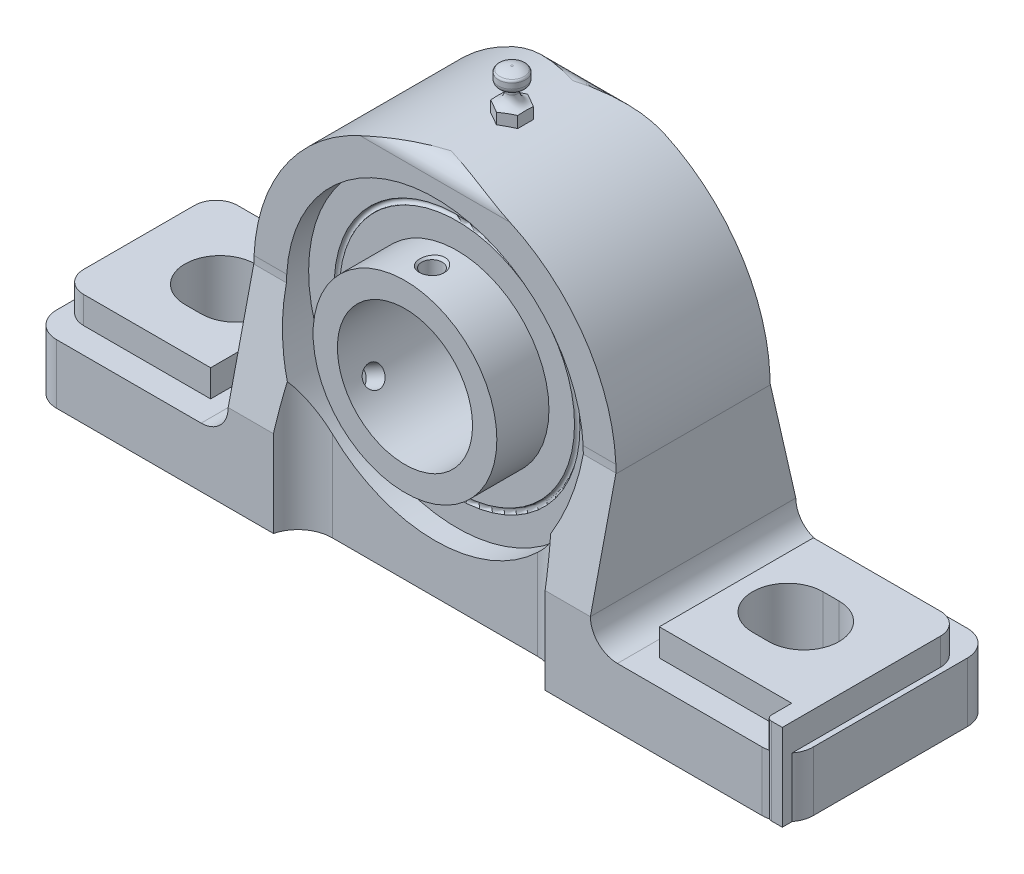
from build123d import *

# Parameters (mm, degrees)
EXTRUDE1_DEPTH      = 3
EXTRUDE1_DEPTH_BACK = 3
SKETCH2_W           = 43.479381443
SKETCH2_H           = 47.087628866
EXTRUDE2_DEPTH      = 19
EXTRUDE2_DEPTH_BACK = 19
SKETCH3_R           = 27.458477013
EXTRUDE3_DEPTH      = 70
EXTRUDE3_DEPTH_BACK = 70
SKETCH5_W           = 560
SKETCH5_H           = 152
EXTRUDE4_DEPTH      = 36.5
EXTRUDE5_REACH      = 97.42
EXTRUDE6_DEPTH      = 16
EXTRUDE7_DEPTH      = 96.420123749
CIRPATTERN1_COUNT   = 2
CIRPATTERN1_ANGLE   = 120


with BuildPart() as part:
    # Sketch1 → Revolve1 (revolve)
    with BuildSketch(Plane(origin=(0, 0, 0), x_dir=(0, 0, -1), z_dir=(1, 0, 0)), mode=Mode.PRIVATE) as revolve1_sk:
        with BuildLine():
            Line((0, 78), (0.17820323, 78))
            ThreePointArc((0.17820323, 78), (1.259498067, 77.851077963), (2.260278589, 77.415400738))
            ThreePointArc((2.260278589, 77.415400738), (2.434907396, 77.235198628), (2.5, 76.992853886))
            Line((2.5, 76.992853886), (2.5, 76.003209488))
            ThreePointArc((2.5, 76.003209488), (2.21161732, 75.293562514), (1.505707946, 74.996148066))
            ThreePointArc((1.505707946, 74.996148066), (1.149821103, 74.853091094), (1, 74.4999985))
            Line((1, 74.4999985), (1, 74))
            ThreePointArc((1, 74), (1.585786438, 72.585786438), (3, 72))
            Line((3, 72), (5, 72))
            Line((5, 72), (5, 68))
            Line((5, 68), (0, 68))
            Line((0, 68), (0, 78))
        make_face()
    revolve(revolve1_sk.sketch.rotate(Axis((0, 68, 0), (0, 1, 0)), 180), axis=Axis((0, 68, 0), (0, 1, 0)))

    # Sketch2 → Extrude1 (cut, two sides: drawn at the far end of the back side and taken through both)
    with BuildSketch(Plane(origin=(0, 70, 0), x_dir=(-1, 0, 0), z_dir=(0, 1, 0)).offset(-EXTRUDE1_DEPTH_BACK)):
        with Locations((-0.902061855, 2.255154639)):
            Rectangle(SKETCH2_W, SKETCH2_H)
        Polygon((2.5, -1.443375673), (2.5, 1.443375673), (0, 2.886751346), (-2.5, 1.443375673), (-2.5, -1.443375673), (0, -2.886751346), align=None, mode=Mode.SUBTRACT)
    extrude(amount=EXTRUDE1_DEPTH + EXTRUDE1_DEPTH_BACK, mode=Mode.SUBTRACT)

    # Sketch3 → Extrude2 (add, two sides: drawn at the far end of the back side and taken through both)
    with BuildSketch(Plane.XY.offset(-EXTRUDE2_DEPTH_BACK)):
        with BuildLine():
            Line((-70, 0), (70, 0))
            Line((70, 0), (70, 11))
            Line((70, 11), (38.5, 11))
            ThreePointArc((38.5, 11), (34.964466094, 12.464466094), (33.5, 16))
            Line((33.5, 16), (33.5, 36.5))
            ThreePointArc((33.5, 36.5), (0, 70), (-33.5, 36.5))
            Line((-33.5, 36.5), (-33.5, 16))
            ThreePointArc((-33.5, 16), (-34.964466094, 12.464466094), (-38.5, 11))
            Line((-38.5, 11), (-70, 11))
            Line((-70, 11), (-70, 0))
        make_face()
        with Locations((0, 36.5)):
            Circle(SKETCH3_R, mode=Mode.SUBTRACT)
    extrude(amount=EXTRUDE2_DEPTH + EXTRUDE2_DEPTH_BACK)

    # Sketch4 → Extrude3 (cut, two sides: drawn at the far end of the back side and taken through both)
    with BuildSketch(Plane(origin=(0, 0, 0), x_dir=(0, 0, -1), z_dir=(1, 0, 0)).offset(-EXTRUDE3_DEPTH_BACK)):
        Polygon((-76, -140), (76, -140), (86.807661708, 204.646339854), (-78.337871198, 217.811941299), align=None)
        with BuildLine():
            Line((-19, 0), (19, 0))
            Line((19, 0), (19, 16))
            Line((19, 16), (14.27198734, 36.629075452))
            ThreePointArc((14.27198734, 36.629075452), (14.255497188, 37.314449572), (14.25, 38))
            Line((14.25, 38), (14.25, 67))
            ThreePointArc((14.25, 67), (13.371320344, 69.121320344), (11.25, 70))
            Line((11.25, 70), (9.3, 70))
            Line((9.3, 70), (9.3, 84.956701031))
            Line((9.3, 84.956701031), (-9.3, 84.956701031))
            Line((-9.3, 84.956701031), (-9.3, 70))
            Line((-9.3, 70), (-11.25, 70))
            ThreePointArc((-11.25, 70), (-13.371320344, 69.121320344), (-14.25, 67))
            Line((-14.25, 67), (-14.25, 38))
            ThreePointArc((-14.25, 38), (-14.255497188, 37.314449572), (-14.27198734, 36.629075452))
            Line((-14.27198734, 36.629075452), (-19, 16))
            Line((-19, 16), (-19, 0))
        make_face(mode=Mode.SUBTRACT)
    extrude(amount=EXTRUDE3_DEPTH + EXTRUDE3_DEPTH_BACK, mode=Mode.SUBTRACT)

    # Sketch5 → Extrude4 (cut)
    with BuildSketch(Plane(origin=(0, 0, 0), x_dir=(1, 0, 0), z_dir=(0, 1, 0))):
        Rectangle(SKETCH5_W, SKETCH5_H)
        with BuildLine():
            Line((-70, 14.25), (-70, -14.25))
            ThreePointArc((-70, -14.25), (-68.608757211, -17.608757211), (-65.25, -19))
            Line((-65.25, -19), (-30.25, -19))
            Line((-30.25, -19), (-25.333333333, -20.583333333))
            ThreePointArc((-25.333333333, -20.583333333), (-23.478342948, -16.104990386), (-19, -14.25))
            Line((-19, -14.25), (19, -14.25))
            ThreePointArc((19, -14.25), (23.478342948, -16.104990386), (25.333333333, -20.583333333))
            Line((25.333333333, -20.583333333), (30.25, -19))
            Line((30.25, -19), (65.25, -19))
            ThreePointArc((65.25, -19), (68.608757211, -17.608757211), (70, -14.25))
            Line((70, -14.25), (70, 14.25))
            ThreePointArc((70, 14.25), (68.608757211, 17.608757211), (65.25, 19))
            Line((65.25, 19), (30.25, 19))
            Line((30.25, 19), (25.333333333, 20.583333333))
            ThreePointArc((25.333333333, 20.583333333), (23.478342948, 16.104990386), (19, 14.25))
            Line((19, 14.25), (-19, 14.25))
            ThreePointArc((-19, 14.25), (-23.478342948, 16.104990386), (-25.333333333, 20.583333333))
            Line((-25.333333333, 20.583333333), (-30.25, 19))
            Line((-30.25, 19), (-65.25, 19))
            ThreePointArc((-65.25, 19), (-68.608757211, 17.608757211), (-70, 14.25))
        make_face(mode=Mode.SUBTRACT)
    extrude(amount=EXTRUDE4_DEPTH, mode=Mode.SUBTRACT)

    # Extrude5: up to this face of the body (flat: up to its plane)
    extrude5_end = Plane(part.part.faces().sort_by_distance((0, 0, 0))[0])
    # Sketch6 → Extrude5 (add, up to the picked face)
    with BuildSketch(Plane(origin=(0, 16, 0), x_dir=(-1, 0, 0), z_dir=(0, 1, 0)), mode=Mode.PRIVATE) as extrude5_sk1:
        with BuildLine():
            Line((-41.5, 14.25), (-66, 14.25))
            Line((-66, 14.25), (-66, 18))
            ThreePointArc((-66, 18), (-66.292893219, 18.707106781), (-67, 19))
            Line((-67, 19), (-69, 19))
            Line((-69, 19), (-69, -10.25))
            ThreePointArc((-69, -10.25), (-67.828427125, -13.078427125), (-65, -14.25))
            Line((-65, -14.25), (-41.5, -14.25))
            Line((-41.5, -14.25), (-41.5, 14.25))
        make_face()
    extrude5_tool1 = split(extrude(extrude5_sk1.sketch, amount=-EXTRUDE5_REACH, mode=Mode.PRIVATE), bisect_by=extrude5_end, keep=Keep.BOTH, mode=Mode.PRIVATE)
    add(extrude5_tool1.solids().sort_by(Axis((55.411217, 16, 0.3509), (0, -1, 0)))[0])

    # Sketch7 → Extrude6 (add)
    with BuildSketch(Plane(origin=(0, 16, 0), x_dir=(-1, 0, 0), z_dir=(0, 1, 0))):
        with BuildLine():
            Line((65, 14.25), (41.5, 14.25))
            Line((41.5, 14.25), (41.5, -14.25))
            Line((41.5, -14.25), (65, -14.25))
            ThreePointArc((65, -14.25), (67.828427125, -13.078427125), (69, -10.25))
            Line((69, -10.25), (69, 10.25))
            ThreePointArc((69, 10.25), (67.828427125, 13.078427125), (65, 14.25))
        make_face()
    extrude(amount=-EXTRUDE6_DEPTH)

    # Sketch8 → Extrude7 (cut, through all)
    with BuildSketch(Plane(origin=(0, 16, 0), x_dir=(1, 0, 0), z_dir=(0, 1, 0))):
        with BuildLine():
            Line((51, -6.5), (54, -6.5))
            ThreePointArc((54, -6.5), (58.596194078, -4.596194078), (60.5, 0))
            ThreePointArc((60.5, 0), (58.596194078, 4.596194078), (54, 6.5))
            Line((54, 6.5), (51, 6.5))
            ThreePointArc((51, 6.5), (46.403805922, 4.596194078), (44.5, 0))
            ThreePointArc((44.5, 0), (46.403805922, -4.596194078), (51, -6.5))
        make_face()
        with BuildLine():
            Line((-54, 6.5), (-51, 6.5))
            ThreePointArc((-51, 6.5), (-46.403805922, 4.596194078), (-44.5, 0))
            ThreePointArc((-44.5, 0), (-46.403805922, -4.596194078), (-51, -6.5))
            Line((-51, -6.5), (-54, -6.5))
            ThreePointArc((-54, -6.5), (-58.596194078, -4.596194078), (-60.5, 0))
            ThreePointArc((-60.5, 0), (-58.596194078, 4.596194078), (-54, 6.5))
        make_face()
    extrude(amount=-EXTRUDE7_DEPTH, mode=Mode.SUBTRACT)

    # Sketch10 → Revolve2 (revolve)
    with BuildSketch(Plane(origin=(0, 0, 0), x_dir=(0, 0, -1), z_dir=(1, 0, 0)), mode=Mode.PRIVATE) as revolve2_sk:
        with BuildLine():
            Line((-19.8, 49), (14.3, 49))
            Line((14.3, 49), (14.3, 53.5))
            Line((14.3, 53.5), (10.164285714, 53.5))
            Line((10.164285714, 53.5), (10.164285714, 58.229238507))
            ThreePointArc((10.164285714, 58.229238507), (9.664285714, 58.729238507), (10.164285714, 59.229238507))
            Line((10.164285714, 59.229238507), (10.164285714, 63.958477013))
            Line((10.164285714, 63.958477013), (-10.164285714, 63.958477013))
            Line((-10.164285714, 63.958477013), (-10.164285714, 59.229238507))
            ThreePointArc((-10.164285714, 59.229238507), (-9.664285714, 58.729238507), (-10.164285714, 58.229238507))
            Line((-10.164285714, 58.229238507), (-10.164285714, 53.5))
            Line((-10.164285714, 53.5), (-19.8, 53.5))
            Line((-19.8, 53.5), (-19.8, 49))
        make_face()
    revolve(revolve2_sk.sketch.rotate(Axis((0, 36.5, -14.3), (0, 0, 1)), 270), axis=Axis((0, 36.5, -14.3), (0, 0, 1)))

    # Sketch11 → Cut-Revolve1 (revolve, cut)
    with BuildSketch(Plane(origin=(0, 0, 0), x_dir=(0, 0, -1), z_dir=(1, 0, 0)), mode=Mode.PRIVATE) as cut_revolve1_sk:
        Polygon((-14.8, 53.5), (-12.406, 53.5), (-12.906, 53), (-12.906, 48.5), (-12.406, 48), (-14.8, 48), align=None)
    cut_revolve1 = revolve(cut_revolve1_sk.sketch.rotate(Axis((0, 48, 14.8), (0, 1, 0)), 180), axis=Axis((0, 48, 14.8), (0, 1, 0)), mode=Mode.SUBTRACT)

    # CirPattern1: Cut-Revolve1 ×2 about axis
    cirpattern1_axis = Axis((0, 36.5, -14.3), (0, 0, 1))
    for i in range(1, CIRPATTERN1_COUNT):
        add(cut_revolve1.rotate(cirpattern1_axis, i * CIRPATTERN1_ANGLE / (CIRPATTERN1_COUNT - 1)), mode=Mode.SUBTRACT)


solid = part.part
